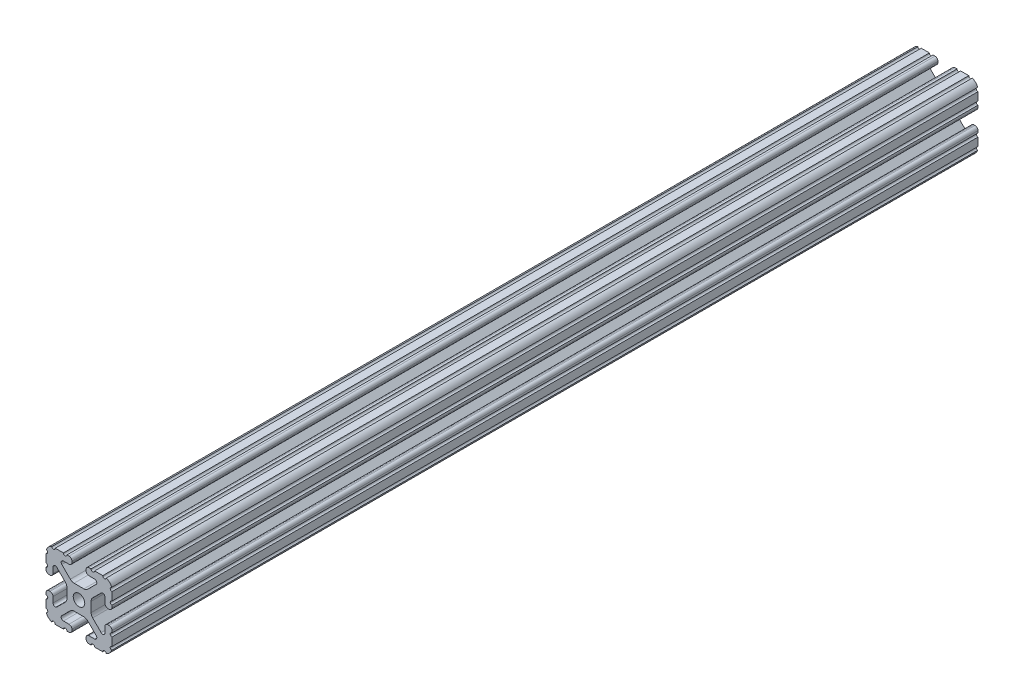
from build123d import *

# Parameters (mm, degrees)
BOSS_EXTRUDE1_DEPTH     = 250
CUT_EXTRUDE1_DEPTH      = 252.447419951
CUT_EXTRUDE1_DEPTH_BACK = 252.447419951
SKETCH5_R               = 1.016


with BuildPart() as part:
    # Sketch4 → Boss-Extrude1 (new, symmetric)
    with BuildSketch(Plane.XY):
        with BuildLine():
            Line((5.7912, -19.05), (14.3002, -19.05))
            ThreePointArc((14.3002, -19.05), (17.658815789, -17.658815789), (19.05, -14.3002))
            Line((19.05, -14.3002), (19.05, -5.7912))
            ThreePointArc((19.05, -5.7912), (18.544114832, -4.569885168), (17.3228, -4.064))
            Line((17.3228, -4.064), (16.7132, -4.064))
            ThreePointArc((16.7132, -4.064), (15.491885168, -4.569885168), (14.986, -5.7912))
            Line((14.986, -5.7912), (14.986, -8.996305235))
            ThreePointArc((14.986, -8.996305235), (14.189232738, -10.188751711), (12.782646215, -9.908964256))
            Line((12.782646215, -9.908964256), (7.888897763, -5.015215804))
            ThreePointArc((7.888897763, -5.015215804), (7.219915375, -4.014012907), (6.985, -2.833013566))
            Line((6.985, -2.833013566), (6.985, 0))
            Line((6.985, 0), (3.3274, 0))
            ThreePointArc((3.3274, 0), (2.352827104, -2.352827104), (0, -3.3274))
            Line((0, -3.3274), (0, -6.985))
            Line((0, -6.985), (2.833013566, -6.985))
            ThreePointArc((2.833013566, -6.985), (4.014012907, -7.219915375), (5.015215804, -7.888897763))
            Line((5.015215804, -7.888897763), (9.908964256, -12.782646215))
            ThreePointArc((9.908964256, -12.782646215), (10.188751711, -14.189232738), (8.996305235, -14.986))
            Line((8.996305235, -14.986), (5.7912, -14.986))
            ThreePointArc((5.7912, -14.986), (4.569885168, -15.491885168), (4.064, -16.7132))
            Line((4.064, -16.7132), (4.064, -17.3228))
            ThreePointArc((4.064, -17.3228), (4.569885168, -18.544114832), (5.7912, -19.05))
        make_face()
    extrude(amount=BOSS_EXTRUDE1_DEPTH, both=True)

    # Sketch5 → Cut-Extrude1 (cut, two sides: drawn at the far end of the back side and taken through both)
    with BuildSketch(Plane.XY.offset(-CUT_EXTRUDE1_DEPTH_BACK)):
        with Locations((14.739477062, -19.05)):
            Circle(SKETCH5_R)
        with Locations((7.980305235, -19.05)):
            Circle(SKETCH5_R)
        with Locations((19.05, -14.739477062)):
            Circle(SKETCH5_R)
        with Locations((19.05, -7.980305235)):
            Circle(SKETCH5_R)
    extrude(amount=CUT_EXTRUDE1_DEPTH + CUT_EXTRUDE1_DEPTH_BACK, mode=Mode.SUBTRACT)

    # Mirror1: part across plane


with BuildPart() as part_1:
    add(part.part)
    add(part.part.mirror(Plane(origin=(0, 0, 0), x_dir=(0, 0, 1), z_dir=(1, 0, 0))))

    # Mirror2: part across plane


with BuildPart() as part_2:
    add(part_1.part)
    add(part_1.part.mirror(Plane.ZX))


solid = part_2.part
